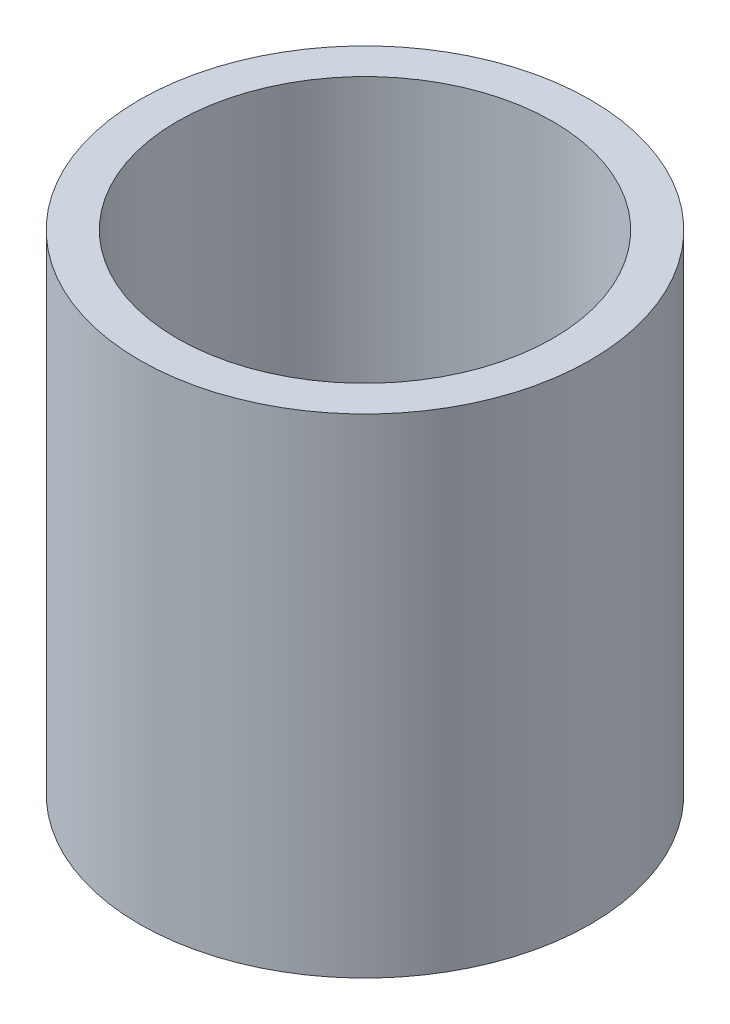
from build123d import *

# Parameters (mm, degrees)
SKETCH1_R           = 4.7625
SKETCH1_R_2         = 3.96875
BOSS_EXTRUDE1_DEPTH = 10.32


with BuildPart() as part:
    # Sketch1 → Boss-Extrude1 (new body)
    with BuildSketch(Plane(origin=(0, 0, 0), x_dir=(1, 0, 0), z_dir=(0, 1, 0))):
        with Locations(Location((0, 0, 0), (0, 0, 270))):
            Circle(SKETCH1_R)
        with Locations(Location((0, 0, 0), (0, 0, 270))):
            Circle(SKETCH1_R_2, mode=Mode.SUBTRACT)
    extrude(amount=BOSS_EXTRUDE1_DEPTH)


solid = part.part
